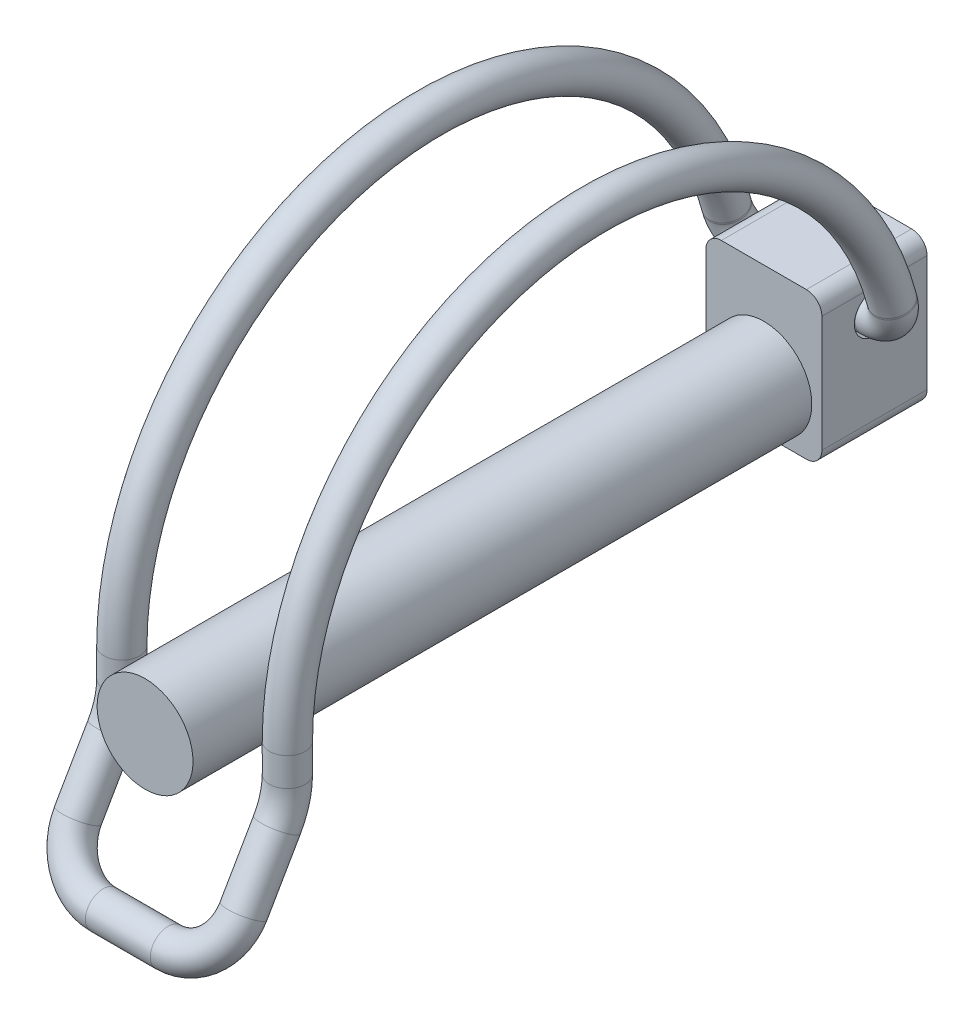
from build123d import *

# Parameters (mm, degrees)
SKETCH1_R               = 3.937
BOSS_EXTRUDE1_DEPTH     = 50.8
BOSS_EXTRUDE2_DEPTH     = 8.636
CUT_EXTRUDE1_DEPTH      = 52.636472696
CUT_EXTRUDE1_DEPTH_BACK = 52.636472696
SKETCH3_R               = 1.651
SKETCH8_R               = 1.4605


with BuildPart() as part:
    # Sketch1 → Boss-Extrude1 (new body)
    with BuildSketch(Plane.XY):
        Circle(SKETCH1_R)
    extrude(amount=BOSS_EXTRUDE1_DEPTH)

    # Sketch2 → Boss-Extrude2 (add)
    with BuildSketch(Plane(origin=(0, 0, 0), x_dir=(-1, 0, 0), z_dir=(0, 0, -1))):
        with BuildLine():
            Line((-3.4925, 7.9375), (3.4925, 7.9375))
            ThreePointArc((3.4925, 7.9375), (4.390525612, 7.565525612), (4.7625, 6.6675))
            Line((4.7625, 6.6675), (4.7625, -2.8575))
            ThreePointArc((4.7625, -2.8575), (4.390525612, -3.755525612), (3.4925, -4.1275))
            Line((3.4925, -4.1275), (-3.4925, -4.1275))
            ThreePointArc((-3.4925, -4.1275), (-4.390525612, -3.755525612), (-4.7625, -2.8575))
            Line((-4.7625, -2.8575), (-4.7625, 6.6675))
            ThreePointArc((-4.7625, 6.6675), (-4.390525612, 7.565525612), (-3.4925, 7.9375))
        make_face()
    extrude(amount=BOSS_EXTRUDE2_DEPTH)

    # Sketch3 → Cut-Extrude1 (cut, two sides: drawn at the far end of the back side and taken through both)
    with BuildSketch(Plane(origin=(0, 0, 0), x_dir=(0, 0, -1), z_dir=(1, 0, 0)).offset(-CUT_EXTRUDE1_DEPTH_BACK)):
        with Locations((4.318, 4.7625)):
            Circle(SKETCH3_R)
    extrude(amount=CUT_EXTRUDE1_DEPTH + CUT_EXTRUDE1_DEPTH_BACK, mode=Mode.SUBTRACT)


with BuildPart() as body_2:
    # Sweep1: sweep along a curve in space
    with BuildLine() as sweep1_path:
        ThreePointArc((-2.667, -13.417019854, 51.574619343), (-5.585583239, -12.370067228, 50.970160963), (-6.7945, -9.8425, 49.510869343))
        Line((-6.7945, -9.8425, 49.510869343), (-6.7945, -5.08, 46.761238686))
        ThreePointArc((-6.7945, -5.08, 46.761238686), (-6.7945, -3.548500936, 46.126871003), (-6.7945, -1.905, 45.9105))
        Line((-6.7945, -1.905, 45.9105), (-6.7945, 0.435792525, 45.9105))
        ThreePointArc((-6.7945, 0.435792525, 45.9105), (-6.7945, 25.468369523, 23.957519165), (-6.7945, 6.970606439, -3.726339663))
        Line((-6.7945, 6.970606439, -3.726339663), (-6.7945, 6.847933859, -3.759209682))
        ThreePointArc((-6.7945, 6.847933859, -3.759209682), (-6.162143541, 5.373309436, -4.154334105), (-4.6355, 4.7625, -4.318))
        Line((-4.6355, 4.7625, -4.318), (4.6355, 4.7625, -4.318))
        ThreePointArc((4.6355, 4.7625, -4.318), (6.162143541, 5.373309436, -4.154334105), (6.7945, 6.847933859, -3.759209682))
        Line((6.7945, 6.847933859, -3.759209682), (6.7945, 6.970606439, -3.726339663))
        ThreePointArc((6.7945, 6.970606439, -3.726339663), (6.7945, 25.468369523, 23.957519165), (6.7945, 0.435792525, 45.9105))
        Line((6.7945, 0.435792525, 45.9105), (6.7945, -1.905, 45.9105))
        ThreePointArc((6.7945, -1.905, 45.9105), (6.7945, -3.548500936, 46.126871003), (6.7945, -5.08, 46.761238686))
        Line((6.7945, -5.08, 46.761238686), (6.7945, -9.8425, 49.510869343))
        ThreePointArc((6.7945, -9.8425, 49.510869343), (5.585583239, -12.370067228, 50.970160963), (2.667, -13.417019854, 51.574619343))
        Line((2.667, -13.417019854, 51.574619343), (-2.667, -13.417019854, 51.574619343))
    # Sketch8 → Sweep1 (sweep)
    with BuildSketch(Plane(origin=(0, 0, 0), x_dir=(0, 0, -1), z_dir=(1, 0, 0))):
        with Locations((4.318, 4.7625)):
            Circle(SKETCH8_R)
    sweep(path=sweep1_path.line)


solid = Compound([part.part, body_2.part])
